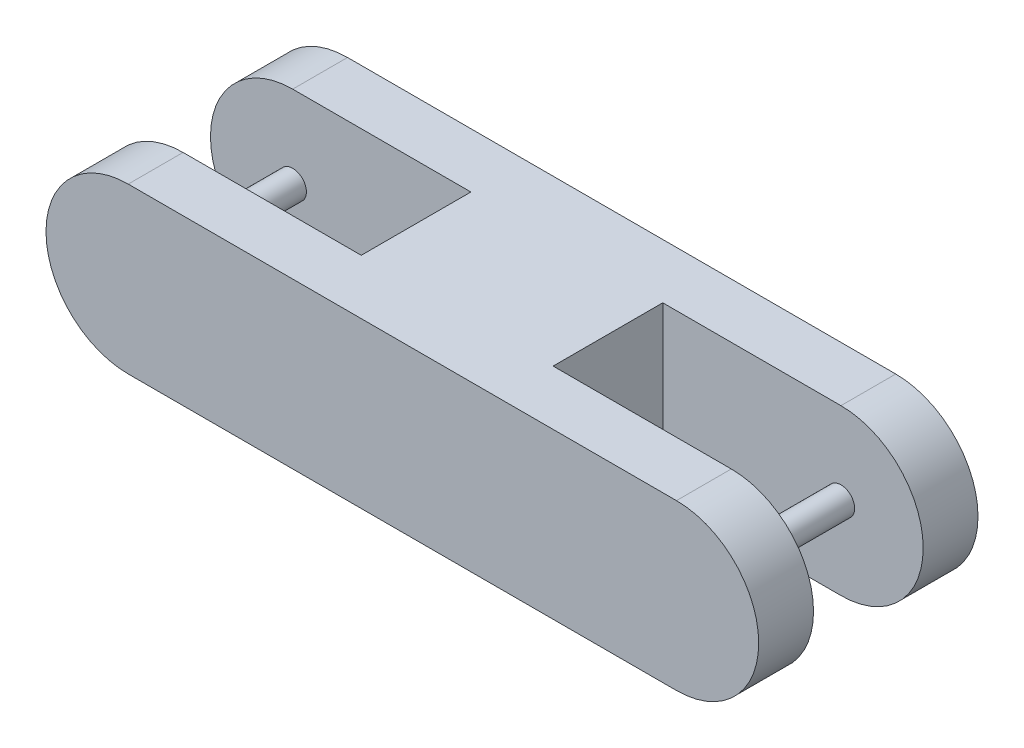
from build123d import *

# Parameters (mm, degrees)
BOSS_EXTRUDE1_DEPTH = 101.6
CUT_EXTRUDE1_START  = -25.4
SKETCH3_W           = 165.1
SKETCH3_H           = 76.2
CUT_EXTRUDE1_DEPTH  = 50.8
BOSS_EXTRUDE2_REACH = 306.27
SKETCH6_R           = 6.35


with BuildPart() as part:
    # Sketch1 → Boss-Extrude1 (new body)
    with BuildSketch(Plane.XY):
        with BuildLine():
            Line((0, 38.1), (254, 38.1))
            ThreePointArc((254, 38.1), (292.1, 0), (254, -38.1))
            Line((254, -38.1), (0, -38.1))
            ThreePointArc((0, -38.1), (-38.1, 0), (0, 38.1))
        make_face()
    extrude(amount=BOSS_EXTRUDE1_DEPTH)

    # Sketch3 → Cut-Extrude1 (cut)
    with BuildSketch(Plane.XY.offset(101.6).offset(CUT_EXTRUDE1_START)):
        Rectangle(SKETCH3_W, SKETCH3_H)
    cut_extrude1 = extrude(amount=-CUT_EXTRUDE1_DEPTH, mode=Mode.SUBTRACT)

    # Mirror1: Cut-Extrude1 across plane
    add(cut_extrude1.mirror(Plane(origin=(127, 0, 0), x_dir=(0, 0, 1), z_dir=(1, 0, 0))), mode=Mode.SUBTRACT)

    # Sketch6 → Boss-Extrude2 (add, up to next)
    with BuildSketch(Plane.XY.offset(25.4), mode=Mode.PRIVATE) as boss_extrude2_sk1:
        with Locations(Location((0, 0, 0), (0, 0, 180))):
            Circle(SKETCH6_R)
    boss_extrude2_tool1 = extrude(boss_extrude2_sk1.sketch, amount=BOSS_EXTRUDE2_REACH, mode=Mode.PRIVATE) - part.part
    boss_extrude2 = boss_extrude2_tool1.solids().sort_by_distance((0, 0, 25.4))[0]
    add(boss_extrude2)

    # Mirror2: Boss-Extrude2 across plane
    add(boss_extrude2.mirror(Plane(origin=(127, 0, 0), x_dir=(0, 0, 1), z_dir=(1, 0, 0))))


solid = part.part
